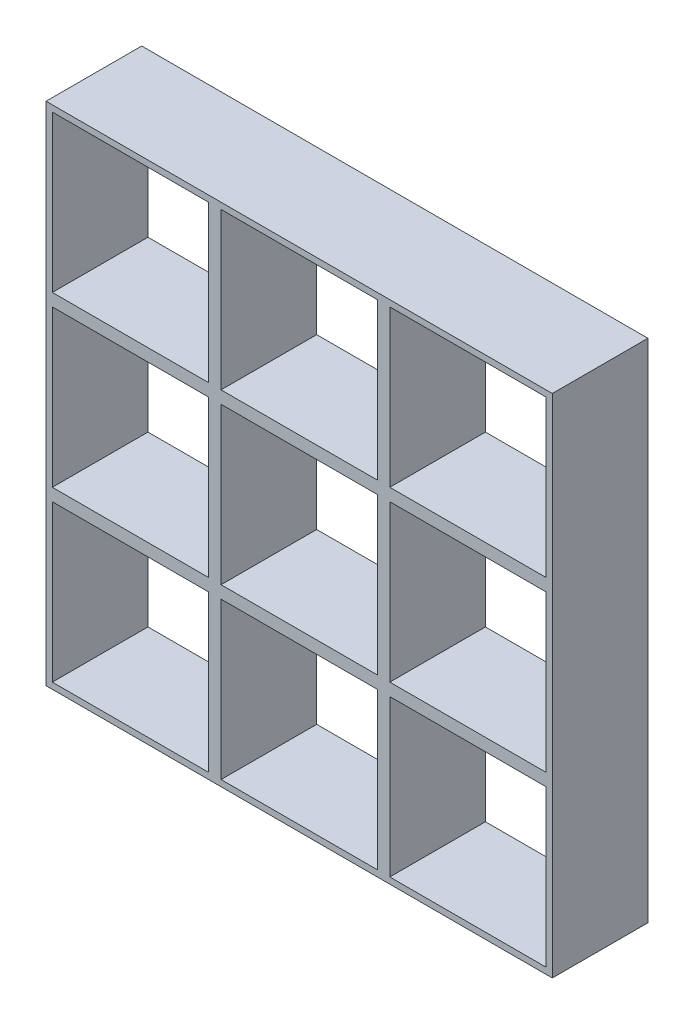
from build123d import *

# Parameters (mm, degrees)
SKETCH1_W           = 1620
SKETCH1_H           = 1620
SKETCH1_W_2         = 500
SKETCH1_H_2         = 500
BOSS_EXTRUDE1_DEPTH = 300
SKETCH2_W           = 1620
SKETCH2_H           = 1620
SKETCH2_W_2         = 500
SKETCH2_H_2         = 500
BOSS_EXTRUDE2_DEPTH = 3
SKETCH3_W           = 1620
SKETCH3_H           = 1620
SKETCH3_W_2         = 500
SKETCH3_H_2         = 500
BOSS_EXTRUDE3_DEPTH = 3


with BuildPart() as part:
    # Sketch1 → Boss-Extrude1 (new body)
    with BuildSketch(Plane.XY):
        with Locations((-207.337883959, -81.092150171)):
            Rectangle(SKETCH1_W, SKETCH1_H)
        with Locations((-747.337883959, -621.092150171)):
            Rectangle(SKETCH1_W_2, SKETCH1_H_2, mode=Mode.SUBTRACT)
        with Locations((-207.337883959, -621.092150171)):
            Rectangle(SKETCH1_W_2, SKETCH1_H_2, mode=Mode.SUBTRACT)
        with Locations((-747.337883959, -81.092150171)):
            Rectangle(SKETCH1_W_2, SKETCH1_H_2, mode=Mode.SUBTRACT)
        with Locations((332.662116041, -81.092150171)):
            Rectangle(SKETCH1_W_2, SKETCH1_H_2, mode=Mode.SUBTRACT)
        with Locations((-747.337883959, 458.907849829)):
            Rectangle(SKETCH1_W_2, SKETCH1_H_2, mode=Mode.SUBTRACT)
        with Locations((-207.337883959, 458.907849829)):
            Rectangle(SKETCH1_W_2, SKETCH1_H_2, mode=Mode.SUBTRACT)
        with Locations((332.662116041, 458.907849829)):
            Rectangle(SKETCH1_W_2, SKETCH1_H_2, mode=Mode.SUBTRACT)
        with Locations((-207.337883959, -81.092150171)):
            Rectangle(SKETCH1_W_2, SKETCH1_H_2, mode=Mode.SUBTRACT)
        with Locations((332.662116041, -621.092150171)):
            Rectangle(SKETCH1_W_2, SKETCH1_H_2, mode=Mode.SUBTRACT)
    extrude(amount=BOSS_EXTRUDE1_DEPTH)

    # Sketch2 → Boss-Extrude2 (add)
    with BuildSketch(Plane.XY.offset(300)):
        with Locations((-207.337883959, -81.092150171)):
            Rectangle(SKETCH2_W, SKETCH2_H)
        with Locations((332.662116041, 458.907849829)):
            Rectangle(SKETCH2_W_2, SKETCH2_H_2, mode=Mode.SUBTRACT)
        with Locations((-747.337883959, 458.907849829)):
            Rectangle(SKETCH2_W_2, SKETCH2_H_2, mode=Mode.SUBTRACT)
        with Locations((-207.337883959, 458.907849829)):
            Rectangle(SKETCH2_W_2, SKETCH2_H_2, mode=Mode.SUBTRACT)
        with Locations((-747.337883959, -81.092150171)):
            Rectangle(SKETCH2_W_2, SKETCH2_H_2, mode=Mode.SUBTRACT)
        with Locations((-207.337883959, -81.092150171)):
            Rectangle(SKETCH2_W_2, SKETCH2_H_2, mode=Mode.SUBTRACT)
        with Locations((332.662116041, -81.092150171)):
            Rectangle(SKETCH2_W_2, SKETCH2_H_2, mode=Mode.SUBTRACT)
        with Locations((-747.337883959, -621.092150171)):
            Rectangle(SKETCH2_W_2, SKETCH2_H_2, mode=Mode.SUBTRACT)
        with Locations((-207.337883959, -621.092150171)):
            Rectangle(SKETCH2_W_2, SKETCH2_H_2, mode=Mode.SUBTRACT)
        with Locations((332.662116041, -621.092150171)):
            Rectangle(SKETCH2_W_2, SKETCH2_H_2, mode=Mode.SUBTRACT)
    extrude(amount=BOSS_EXTRUDE2_DEPTH)

    # Sketch3 → Boss-Extrude3 (add)
    with BuildSketch(Plane(origin=(0, 0, 0), x_dir=(-1, 0, 0), z_dir=(0, 0, -1))):
        with Locations((207.337883959, -81.092150171)):
            Rectangle(SKETCH3_W, SKETCH3_H)
        with Locations((747.337883959, -621.092150171)):
            Rectangle(SKETCH3_W_2, SKETCH3_H_2, mode=Mode.SUBTRACT)
        with Locations((207.337883959, -621.092150171)):
            Rectangle(SKETCH3_W_2, SKETCH3_H_2, mode=Mode.SUBTRACT)
        with Locations((-332.662116041, -621.092150171)):
            Rectangle(SKETCH3_W_2, SKETCH3_H_2, mode=Mode.SUBTRACT)
        with Locations((207.337883959, -81.092150171)):
            Rectangle(SKETCH3_W_2, SKETCH3_H_2, mode=Mode.SUBTRACT)
        with Locations((-332.662116041, -81.092150171)):
            Rectangle(SKETCH3_W_2, SKETCH3_H_2, mode=Mode.SUBTRACT)
        with Locations((207.337883959, 458.907849829)):
            Rectangle(SKETCH3_W_2, SKETCH3_H_2, mode=Mode.SUBTRACT)
        with Locations((747.337883959, -81.092150171)):
            Rectangle(SKETCH3_W_2, SKETCH3_H_2, mode=Mode.SUBTRACT)
        with Locations((747.337883959, 458.907849829)):
            Rectangle(SKETCH3_W_2, SKETCH3_H_2, mode=Mode.SUBTRACT)
        with Locations((-332.662116041, 458.907849829)):
            Rectangle(SKETCH3_W_2, SKETCH3_H_2, mode=Mode.SUBTRACT)
    extrude(amount=BOSS_EXTRUDE3_DEPTH)


solid = part.part
